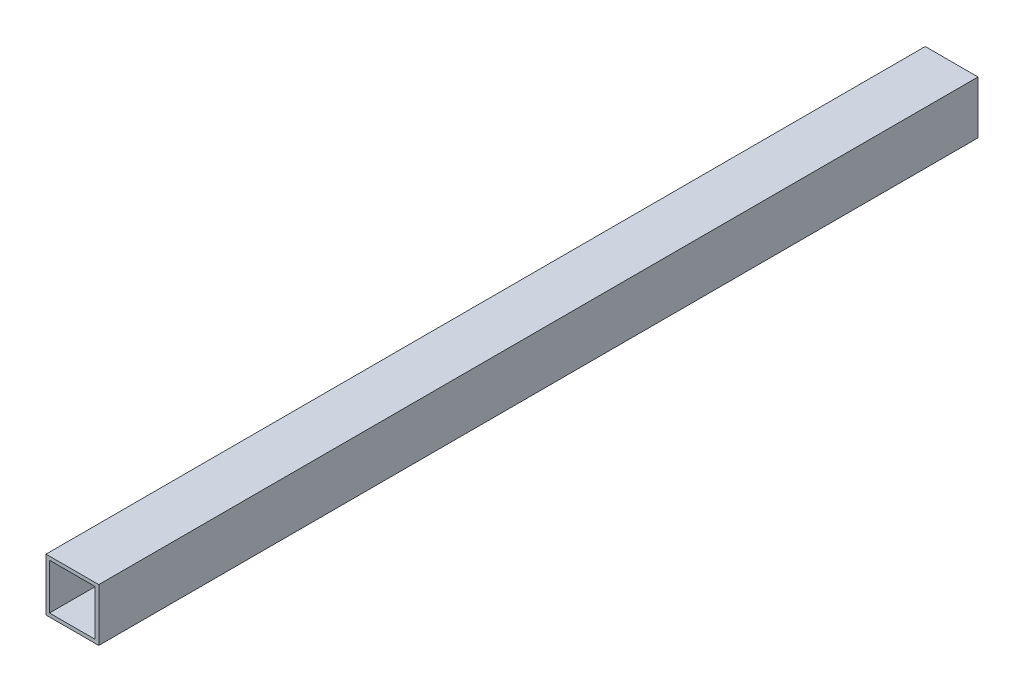
from build123d import *

# Parameters (mm, degrees)
CROQUIS1_W            = 30
CROQUIS1_H            = 30
CROQUIS1_W_2          = 26
CROQUIS1_H_2          = 26
EXTRUIR_L_MINA1_DEPTH = 500


with BuildPart() as part:
    # Croquis1 → Extruir-Lámina1 (new body)
    with BuildSketch(Plane.XY):
        Rectangle(CROQUIS1_W, CROQUIS1_H)
        Rectangle(CROQUIS1_W_2, CROQUIS1_H_2, mode=Mode.SUBTRACT)
    extrude(amount=EXTRUIR_L_MINA1_DEPTH)


solid = part.part
